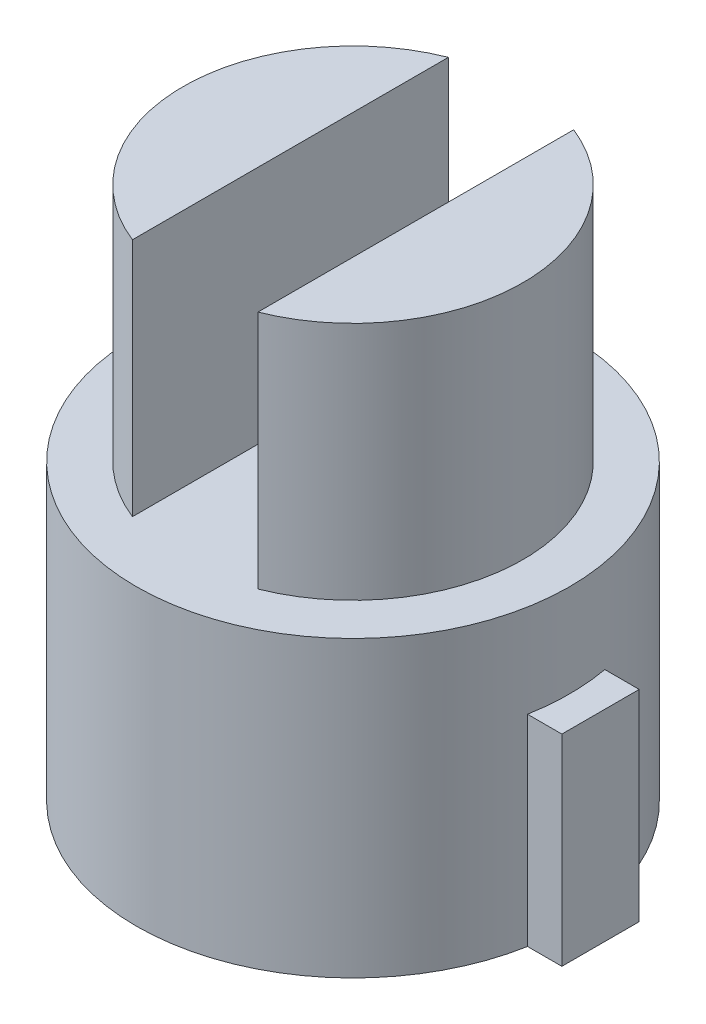
from build123d import *

# Parameters (mm, degrees)
BOSS_EXTRUDE1_DEPTH   = 34.5
BOSS_EXTRUDE1_2_DEPTH = 34.5
SKETCH1_4_R           = 14
BOSS_EXTRUDE2_DEPTH   = 19
BOSS_EXTRUDE3_DEPTH   = 13


with BuildPart() as part:
    # Sketch1 → Boss-Extrude1 (new body)
    with BuildSketch(Plane(origin=(0, 0, 0), x_dir=(1, 0, 0), z_dir=(0, 1, 0))):
        with BuildLine():
            ThreePointArc((4.058218824, -10.202512434), (10.98, 0), (4.058218824, 10.202512434))
            Line((4.058218824, 10.202512434), (4.058218824, -10.202512434))
        make_face()
    extrude(amount=BOSS_EXTRUDE1_DEPTH)



with BuildPart() as body_2:
    # Sketch1 → Boss-Extrude1 2 (new body)
    with BuildSketch(Plane(origin=(0, 0, 0), x_dir=(1, 0, 0), z_dir=(0, 1, 0))):
        with BuildLine():
            Line((-4.043488658, -10.208359294), (-4.043488658, 10.208359294))
            ThreePointArc((-4.043488658, 10.208359294), (-10.98, 0), (-4.043488658, -10.208359294))
        make_face()
    extrude(amount=BOSS_EXTRUDE1_2_DEPTH)


with BuildPart() as part_1:
    add(part.part)

    add(body_2.part)  # Boss-Extrude2 merges body 2
    # Sketch1<4> → Boss-Extrude2 (add)
    with BuildSketch(Plane(origin=(0, 0, 0), x_dir=(1, 0, 0), z_dir=(0, 1, 0))):
        Circle(SKETCH1_4_R)
        with BuildLine():
            Line((-4.043488658, 2.501755217), (-4.043488658, -10.208359294))
            ThreePointArc((-4.043488658, -10.208359294), (-4.044654217, -10.207897544), (-4.045819724, -10.20743566))
            ThreePointArc((-4.045819724, -10.20743566), (-10.979999928, 0.001253691), (-4.043488658, 10.208359294))
            Line((-4.043488658, 10.208359294), (-4.043488658, 2.501755217))
        make_face(mode=Mode.SUBTRACT)
        with BuildLine():
            Line((4.058218824, 2.5), (4.058218824, 10.202512434))
            ThreePointArc((4.058218824, 10.202512434), (10.98, 0), (4.058218824, -10.202512434))
            Line((4.058218824, -10.202512434), (4.058218824, 2.5))
        make_face(mode=Mode.SUBTRACT)
    extrude(amount=BOSS_EXTRUDE2_DEPTH)

    # Sketch1<5> → Boss-Extrude3 (add)
    with BuildSketch(Plane(origin=(0, 0, 0), x_dir=(1, 0, 0), z_dir=(0, 1, 0))):
        with BuildLine():
            ThreePointArc((13.774977314, 2.5), (13.999999972, 0.000891934), (13.77529575, -2.498244783))
            Line((13.77529575, -2.498244783), (15.995322261, -2.498244783))
            Line((15.995322261, -2.498244783), (15.995322261, 2.5))
            Line((15.995322261, 2.5), (13.774977314, 2.5))
        make_face()
        with BuildLine():
            Line((-16, -2.498244783), (-13.77529575, -2.498244783))
            ThreePointArc((-13.77529575, -2.498244783), (-13.999999886, 0.001783889), (-13.774658647, 2.501755217))
            Line((-13.774658647, 2.501755217), (-16, 2.501755217))
            Line((-16, 2.501755217), (-16, -2.498244783))
        make_face()
    extrude(amount=BOSS_EXTRUDE3_DEPTH)


solid = part_1.part
